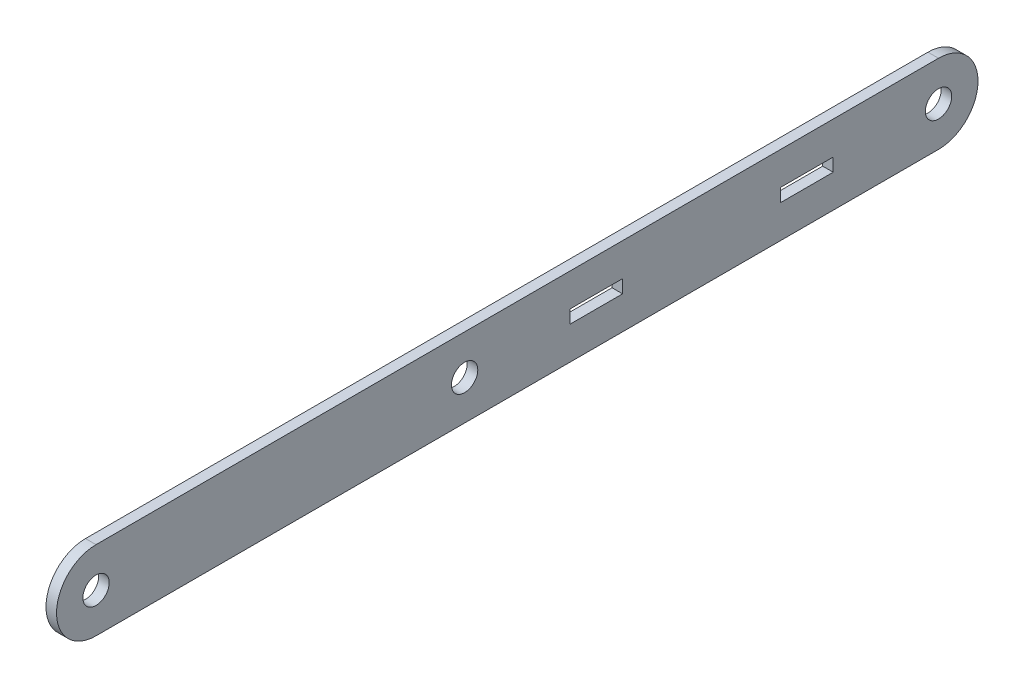
from build123d import *

# Parameters (mm, degrees)
SCHIZZO1_R                   = 2.5
SCHIZZO1_W                   = 10
SCHIZZO1_H                   = 2.5
ESTRUSIONE_ESTRUSIONE1_DEPTH = 2


with BuildPart() as part:
    # Schizzo1 → Estrusione-Estrusione1 (new body)
    with BuildSketch(Plane(origin=(0, 0, 0), x_dir=(0, 0, -1), z_dir=(1, 0, 0))):
        with BuildLine():
            Line((80, -7.5), (-80, -7.5))
            ThreePointArc((-80, -7.5), (-87.5, 0), (-80, 7.5))
            Line((-80, 7.5), (80, 7.5))
            ThreePointArc((80, 7.5), (87.5, 0), (80, -7.5))
        make_face()
        with Locations((-80, 0)):
            Circle(SCHIZZO1_R, mode=Mode.SUBTRACT)
        with Locations((80, 0)):
            Circle(SCHIZZO1_R, mode=Mode.SUBTRACT)
        with Locations((-10, 0)):
            Circle(SCHIZZO1_R, mode=Mode.SUBTRACT)
        with Locations((15, 0)):
            Rectangle(SCHIZZO1_W, SCHIZZO1_H, mode=Mode.SUBTRACT)
        with Locations((55, 0)):
            Rectangle(SCHIZZO1_W, SCHIZZO1_H, mode=Mode.SUBTRACT)
    extrude(amount=ESTRUSIONE_ESTRUSIONE1_DEPTH)


solid = part.part
